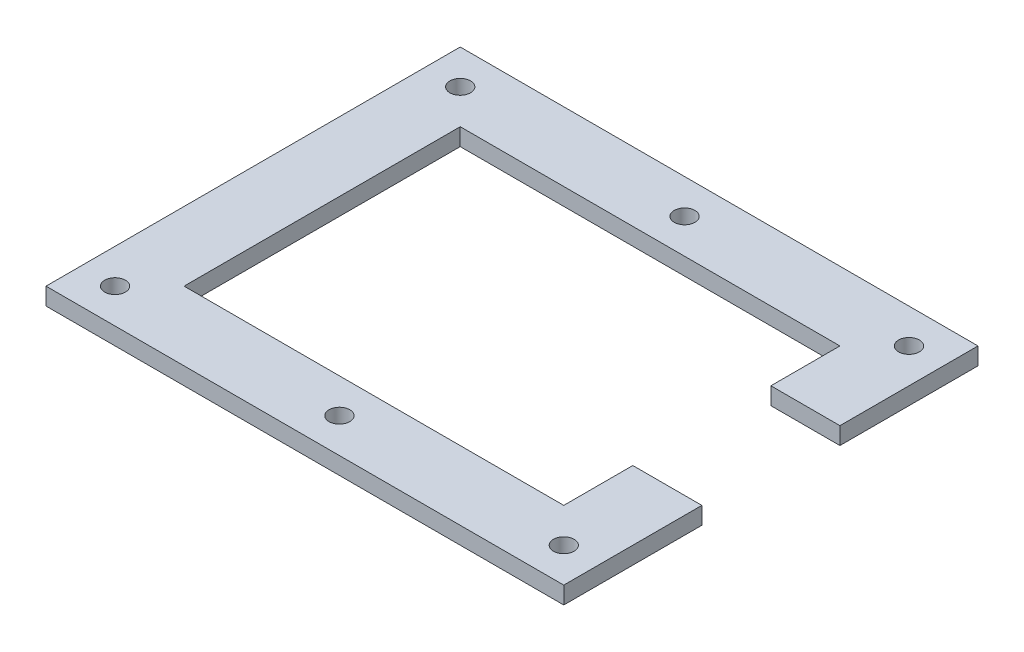
from build123d import *

# Parameters (mm, degrees)
EXTRUDE_2_DEPTH     = 2.5
SKETCH_2_R          = 1.5
CUT_EXTRUDE_1_DEPTH = 81.816149376


with BuildPart() as part:
    # 草图1 → 凸台-拉伸2 (new body)
    with BuildSketch(Plane(origin=(0, 0, 0), x_dir=(1, 0, 0), z_dir=(0, 1, 0))):
        Polygon((0, -30), (0, 30), (75, 30), (75, 10), (65, 10), (65, 20), (10, 20), (10, -20), (65, -20), (65, -10), (75, -10), (75, -30), align=None)
    extrude(amount=EXTRUDE_2_DEPTH)

    # 草图2 → 切除-拉伸1 (cut, through all)
    with BuildSketch(Plane(origin=(0, 0, 0), x_dir=(1, 0, 0), z_dir=(0, 1, 0))):
        with Locations(Location((5, 25, 0), (0, 0, 270))):
            Circle(SKETCH_2_R)
        with Locations(Location((70, 25, 0), (0, 0, 90))):
            Circle(SKETCH_2_R)
        with Locations(Location((70, -25, 0), (0, 0, 270))):
            Circle(SKETCH_2_R)
        with Locations(Location((5, -25, 0), (0, 0, 90))):
            Circle(SKETCH_2_R)
        with Locations(Location((37.5, -25, 0), (0, 0, 90))):
            Circle(SKETCH_2_R)
        with Locations(Location((37.5, 25, 0), (0, 0, 270))):
            Circle(SKETCH_2_R)
    extrude(amount=CUT_EXTRUDE_1_DEPTH, mode=Mode.SUBTRACT)


solid = part.part
